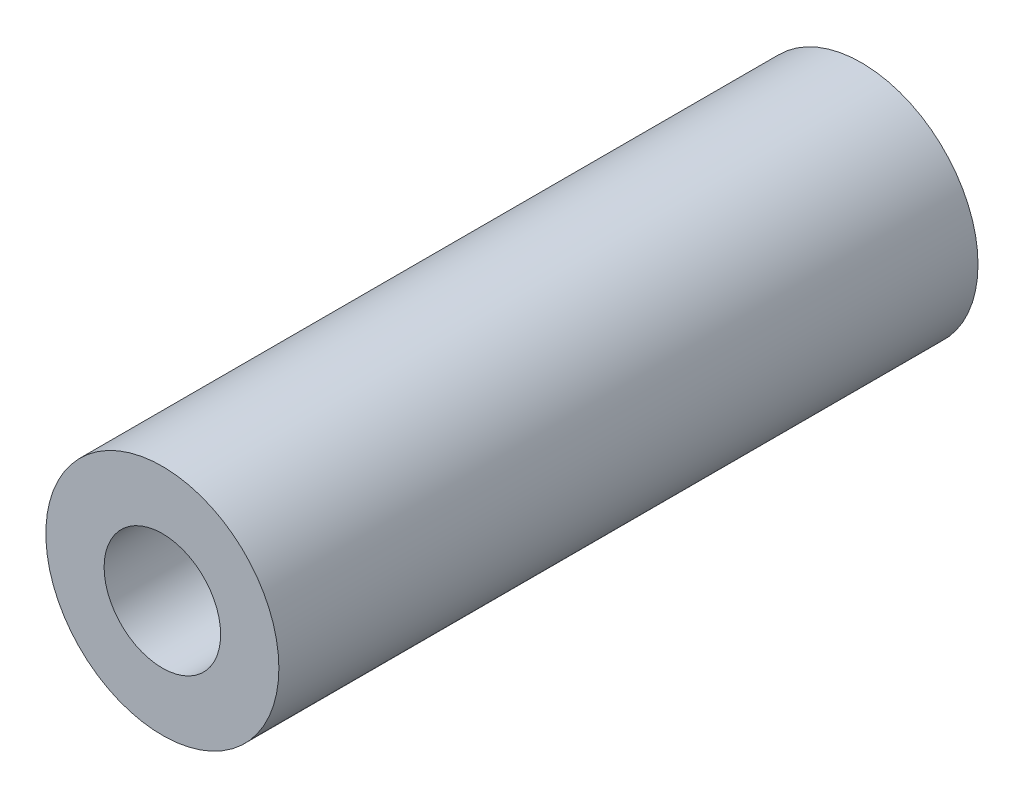
from build123d import *

# Parameters (mm, degrees)
ESQUISSE1_R             = 5
BOSS_EXTRU_1_DEPTH      = 30
ENL_V_MAT_EXTRU_1_REACH = 32.822
ESQUISSE2_R             = 2.5


with BuildPart() as part:
    # Esquisse1 → Boss.-Extru.1 (new body)
    with BuildSketch(Plane.XY):
        Circle(ESQUISSE1_R)
    extrude(amount=BOSS_EXTRU_1_DEPTH)

    # Esquisse2 → Enlèv. mat.-Extru.1 (cut, up to next)
    with BuildSketch(Plane(origin=(0, 0, 0), x_dir=(-1, 0, 0), z_dir=(0, 0, -1)), mode=Mode.PRIVATE) as enl_v_mat_extru_1_sk1:
        Circle(ESQUISSE2_R)
    enl_v_mat_extru_1_tool1 = extrude(enl_v_mat_extru_1_sk1.sketch, amount=-ENL_V_MAT_EXTRU_1_REACH, mode=Mode.PRIVATE) & part.part
    add(enl_v_mat_extru_1_tool1.solids().sort_by_distance((0, 0, 0))[0], mode=Mode.SUBTRACT)


solid = part.part
